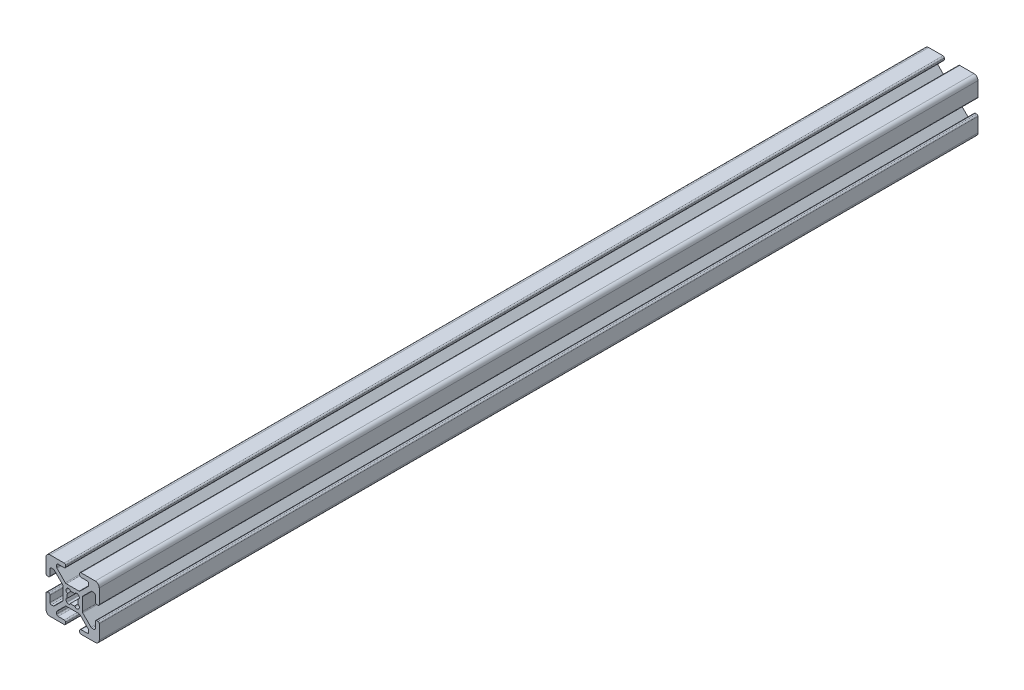
from build123d import *

# Parameters (mm, degrees)
EXTRUDE1_DEPTH      = 280
EXTRUDE1_DEPTH_BACK = 50


with BuildPart() as part:
    # Sketch1 → Extrude1 (new, two sides: drawn at the far end of the back side and taken through both)
    with BuildSketch(Plane.XY.offset(-EXTRUDE1_DEPTH_BACK)):
        with BuildLine():
            Line((-5.032287798, -0.341059771), (-5.516287798, -0.341059771))
            ThreePointArc((-5.516287798, -0.341059771), (-5.875498042, -0.192270016), (-6.024287798, 0.166940229))
            Line((-6.024287798, 0.166940229), (-6.024287798, 2.515940229))
            ThreePointArc((-6.024287798, 2.515940229), (-6.173077553, 2.875150474), (-6.532287798, 3.023940229))
            Line((-6.532287798, 3.023940229), (-7.258207136, 3.023940229))
            ThreePointArc((-7.258207136, 3.023940229), (-7.45261032, 2.985271032), (-7.617417381, 2.875150474))
            Line((-7.617417381, 2.875150474), (-10.720498042, -0.227930187))
            ThreePointArc((-10.720498042, -0.227930187), (-10.8306186, -0.392737249), (-10.869287798, -0.587140432))
            Line((-10.869287798, -0.587140432), (-10.869287798, -5.354979109))
            ThreePointArc((-10.869287798, -5.354979109), (-10.8306186, -5.549382293), (-10.720498042, -5.714189354))
            Line((-10.720498042, -5.714189354), (-7.617417381, -8.817270016))
            ThreePointArc((-7.617417381, -8.817270016), (-7.45261032, -8.927390573), (-7.258207136, -8.966059771))
            Line((-7.258207136, -8.966059771), (-6.532287798, -8.966059771))
            ThreePointArc((-6.532287798, -8.966059771), (-6.173077553, -8.817270016), (-6.024287798, -8.458059771))
            Line((-6.024287798, -8.458059771), (-6.024287798, -6.109059771))
            ThreePointArc((-6.024287798, -6.109059771), (-5.875498042, -5.749849526), (-5.516287798, -5.601059771))
            Line((-5.516287798, -5.601059771), (-5.032287798, -5.601059771))
            ThreePointArc((-5.032287798, -5.601059771), (-4.673077553, -5.749849526), (-4.524287798, -6.109059771))
            Line((-4.524287798, -6.109059771), (-4.524287798, -11.471059771))
            ThreePointArc((-4.524287798, -11.471059771), (-4.963627626, -12.531719943), (-6.024287798, -12.971059771))
            Line((-6.024287798, -12.971059771), (-11.386287798, -12.971059771))
            ThreePointArc((-11.386287798, -12.971059771), (-11.745498042, -12.822270016), (-11.894287798, -12.463059771))
            Line((-11.894287798, -12.463059771), (-11.894287798, -11.979059771))
            ThreePointArc((-11.894287798, -11.979059771), (-11.745498042, -11.619849526), (-11.386287798, -11.471059771))
            Line((-11.386287798, -11.471059771), (-9.037287798, -11.471059771))
            ThreePointArc((-9.037287798, -11.471059771), (-8.678077553, -11.322270016), (-8.529287798, -10.963059771))
            Line((-8.529287798, -10.963059771), (-8.529287798, -10.237140432))
            ThreePointArc((-8.529287798, -10.237140432), (-8.567956995, -10.042737249), (-8.678077553, -9.877930187))
            Line((-8.678077553, -9.877930187), (-11.781158214, -6.774849526))
            ThreePointArc((-11.781158214, -6.774849526), (-11.945965275, -6.664728968), (-12.140368459, -6.626059771))
            Line((-12.140368459, -6.626059771), (-16.908207136, -6.626059771))
            ThreePointArc((-16.908207136, -6.626059771), (-17.10261032, -6.664728968), (-17.267417381, -6.774849526))
            Line((-17.267417381, -6.774849526), (-20.370498042, -9.877930187))
            ThreePointArc((-20.370498042, -9.877930187), (-20.4806186, -10.042737249), (-20.519287798, -10.237140432))
            Line((-20.519287798, -10.237140432), (-20.519287798, -10.963059771))
            ThreePointArc((-20.519287798, -10.963059771), (-20.370498042, -11.322270016), (-20.011287798, -11.471059771))
            Line((-20.011287798, -11.471059771), (-17.662287798, -11.471059771))
            ThreePointArc((-17.662287798, -11.471059771), (-17.303077553, -11.619849526), (-17.154287798, -11.979059771))
            Line((-17.154287798, -11.979059771), (-17.154287798, -12.463059771))
            ThreePointArc((-17.154287798, -12.463059771), (-17.303077553, -12.822270016), (-17.662287798, -12.971059771))
            Line((-17.662287798, -12.971059771), (-23.024287798, -12.971059771))
            ThreePointArc((-23.024287798, -12.971059771), (-24.084947969, -12.531719943), (-24.524287798, -11.471059771))
            Line((-24.524287798, -11.471059771), (-24.524287798, -6.109059771))
            ThreePointArc((-24.524287798, -6.109059771), (-24.375498042, -5.749849526), (-24.016287798, -5.601059771))
            Line((-24.016287798, -5.601059771), (-23.532287798, -5.601059771))
            ThreePointArc((-23.532287798, -5.601059771), (-23.173077553, -5.749849526), (-23.024287798, -6.109059771))
            Line((-23.024287798, -6.109059771), (-23.024287798, -8.458059771))
            ThreePointArc((-23.024287798, -8.458059771), (-22.875498042, -8.817270016), (-22.516287798, -8.966059771))
            Line((-22.516287798, -8.966059771), (-21.790368459, -8.966059771))
            ThreePointArc((-21.790368459, -8.966059771), (-21.595965275, -8.927390573), (-21.431158214, -8.817270016))
            Line((-21.431158214, -8.817270016), (-18.328077553, -5.714189354))
            ThreePointArc((-18.328077553, -5.714189354), (-18.217956995, -5.549382293), (-18.179287798, -5.354979109))
            Line((-18.179287798, -5.354979109), (-18.179287798, -0.587140432))
            ThreePointArc((-18.179287798, -0.587140432), (-18.217956995, -0.392737249), (-18.328077553, -0.227930187))
            Line((-18.328077553, -0.227930187), (-21.431158214, 2.875150474))
            ThreePointArc((-21.431158214, 2.875150474), (-21.595965275, 2.985271032), (-21.790368459, 3.023940229))
            Line((-21.790368459, 3.023940229), (-22.516287798, 3.023940229))
            ThreePointArc((-22.516287798, 3.023940229), (-22.875498042, 2.875150474), (-23.024287798, 2.515940229))
            Line((-23.024287798, 2.515940229), (-23.024287798, 0.166940229))
            ThreePointArc((-23.024287798, 0.166940229), (-23.173077553, -0.192270016), (-23.532287798, -0.341059771))
            Line((-23.532287798, -0.341059771), (-24.016287798, -0.341059771))
            ThreePointArc((-24.016287798, -0.341059771), (-24.375498042, -0.192270016), (-24.524287798, 0.166940229))
            Line((-24.524287798, 0.166940229), (-24.524287798, 5.528940229))
            ThreePointArc((-24.524287798, 5.528940229), (-24.084947969, 6.589600401), (-23.024287798, 7.028940229))
            Line((-23.024287798, 7.028940229), (-17.662287798, 7.028940229))
            ThreePointArc((-17.662287798, 7.028940229), (-17.303077553, 6.880150474), (-17.154287798, 6.520940229))
            Line((-17.154287798, 6.520940229), (-17.154287798, 6.036940229))
            ThreePointArc((-17.154287798, 6.036940229), (-17.303077553, 5.677729984), (-17.662287798, 5.528940229))
            Line((-17.662287798, 5.528940229), (-20.011287798, 5.528940229))
            ThreePointArc((-20.011287798, 5.528940229), (-20.370498042, 5.380150474), (-20.519287798, 5.020940229))
            Line((-20.519287798, 5.020940229), (-20.519287798, 4.295020891))
            ThreePointArc((-20.519287798, 4.295020891), (-20.4806186, 4.100617707), (-20.370498042, 3.935810646))
            Line((-20.370498042, 3.935810646), (-17.267417381, 0.832729984))
            ThreePointArc((-17.267417381, 0.832729984), (-17.10261032, 0.722609427), (-16.908207136, 0.683940229))
            Line((-16.908207136, 0.683940229), (-12.140368459, 0.683940229))
            ThreePointArc((-12.140368459, 0.683940229), (-11.945965275, 0.722609427), (-11.781158214, 0.832729984))
            Line((-11.781158214, 0.832729984), (-8.678077553, 3.935810646))
            ThreePointArc((-8.678077553, 3.935810646), (-8.567956995, 4.100617707), (-8.529287798, 4.295020891))
            Line((-8.529287798, 4.295020891), (-8.529287798, 5.020940229))
            ThreePointArc((-8.529287798, 5.020940229), (-8.678077553, 5.380150474), (-9.037287798, 5.528940229))
            Line((-9.037287798, 5.528940229), (-11.386287798, 5.528940229))
            ThreePointArc((-11.386287798, 5.528940229), (-11.745498042, 5.677729984), (-11.894287798, 6.036940229))
            Line((-11.894287798, 6.036940229), (-11.894287798, 6.520940229))
            ThreePointArc((-11.894287798, 6.520940229), (-11.745498042, 6.880150474), (-11.386287798, 7.028940229))
            Line((-11.386287798, 7.028940229), (-6.024287798, 7.028940229))
            ThreePointArc((-6.024287798, 7.028940229), (-4.963627626, 6.589600401), (-4.524287798, 5.528940229))
            Line((-4.524287798, 5.528940229), (-4.524287798, 0.166940229))
            ThreePointArc((-4.524287798, 0.166940229), (-4.673077553, -0.192270016), (-5.032287798, -0.341059771))
        make_face()
        with BuildLine():
            Line((-12.399386954, -5.275565737), (-12.219781831, -5.095960615))
            ThreePointArc((-12.219781831, -5.095960615), (-12.018349781, -4.327527582), (-12.589154291, -3.775036489))
            ThreePointArc((-12.589154291, -3.775036489), (-12.428787798, -2.971059771), (-12.589154291, -2.167083053))
            ThreePointArc((-12.589154291, -2.167083053), (-12.018349781, -1.61459196), (-12.219781831, -0.846158927))
            Line((-12.219781831, -0.846158927), (-12.399386954, -0.666553805))
            ThreePointArc((-12.399386954, -0.666553805), (-13.167819987, -0.465121754), (-13.72031108, -1.035926265))
            ThreePointArc((-13.72031108, -1.035926265), (-14.524287798, -0.875559771), (-15.328264516, -1.035926265))
            ThreePointArc((-15.328264516, -1.035926265), (-15.880755608, -0.465121754), (-16.649188641, -0.666553805))
            Line((-16.649188641, -0.666553805), (-16.828793764, -0.846158927))
            ThreePointArc((-16.828793764, -0.846158927), (-17.030225814, -1.61459196), (-16.459421304, -2.167083053))
            ThreePointArc((-16.459421304, -2.167083053), (-16.619787798, -2.971059771), (-16.459421304, -3.775036489))
            ThreePointArc((-16.459421304, -3.775036489), (-17.030225814, -4.327527582), (-16.828793764, -5.095960615))
            Line((-16.828793764, -5.095960615), (-16.649188641, -5.275565737))
            ThreePointArc((-16.649188641, -5.275565737), (-15.880755608, -5.476997788), (-15.328264516, -4.906193277))
            ThreePointArc((-15.328264516, -4.906193277), (-14.524287798, -5.066559771), (-13.72031108, -4.906193277))
            ThreePointArc((-13.72031108, -4.906193277), (-13.167819987, -5.476997788), (-12.399386954, -5.275565737))
        make_face(mode=Mode.SUBTRACT)
    extrude(amount=EXTRUDE1_DEPTH + EXTRUDE1_DEPTH_BACK)


solid = part.part
